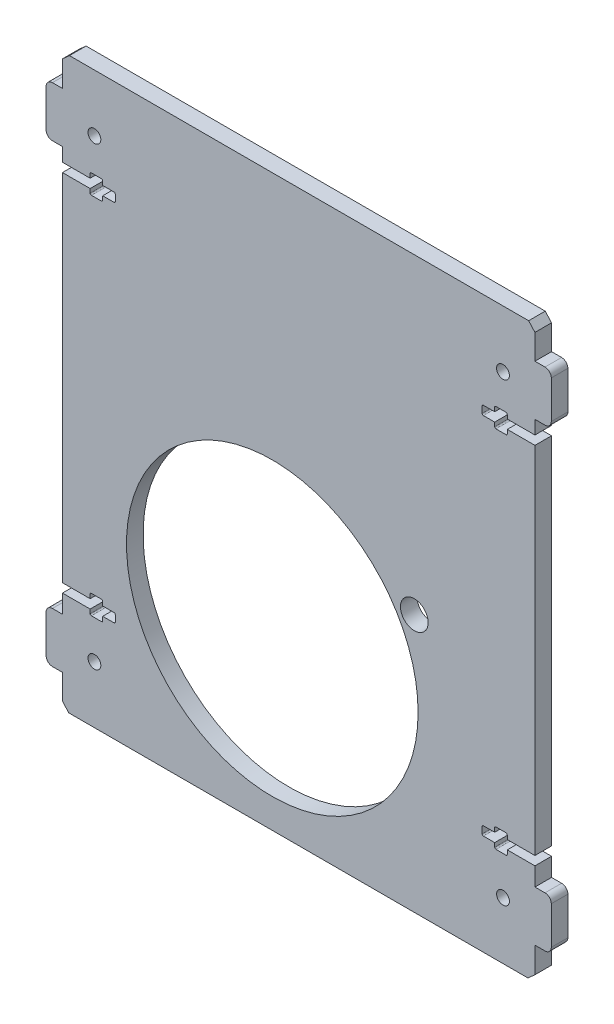
from build123d import *

# Parameters (mm, degrees)
MODEL_R             = 57.954171366
MODEL_R_2           = 2.55
MODEL_R_3           = 5.5
BOSS_EXTRUDE1_DEPTH = 6.6


with BuildPart() as part:
    # Model → Boss-Extrude1 (new body)
    with BuildSketch(Plane.XY):
        with BuildLine():
            Line((93.9, 110.423468713), (91.4, 113.2))
            Line((91.4, 113.2), (-91.123468713, 113.2))
            Line((-91.123468713, 113.2), (-93.9, 110.7))
            Line((-93.9, 110.7), (-93.9, 100.5))
            Line((-93.9, 100.5), (-97.9, 100.5))
            ThreePointArc((-97.9, 100.5), (-99.667766953, 99.767766953), (-100.4, 98))
            Line((-100.4, 98), (-100.4, 83))
            ThreePointArc((-100.4, 83), (-99.667766953, 81.232233047), (-97.9, 80.5))
            Line((-97.9, 80.5), (-93.9, 80.5))
            Line((-93.9, 80.5), (-93.9, 75.1))
            Line((-93.9, 75.1), (-82.9, 75.1))
            Line((-82.9, 75.1), (-82.9, 76.685))
            ThreePointArc((-82.9, 76.685), (-82.753553391, 77.038553391), (-82.4, 77.185))
            Line((-82.4, 77.185), (-78.4, 77.185))
            ThreePointArc((-78.4, 77.185), (-78.046446609, 77.038553391), (-77.9, 76.685))
            Line((-77.9, 76.685), (-77.9, 75.1))
            Line((-77.9, 75.1), (-73.4, 75.1))
            ThreePointArc((-73.4, 75.1), (-73.046446609, 74.953553391), (-72.9, 74.6))
            Line((-72.9, 74.6), (-72.9, 72.05))
            ThreePointArc((-72.9, 72.05), (-73.046446609, 71.696446609), (-73.4, 71.55))
            Line((-73.4, 71.55), (-77.9, 71.55))
            Line((-77.9, 71.55), (-77.9, 69.965))
            ThreePointArc((-77.9, 69.965), (-78.046446609, 69.611446609), (-78.4, 69.465))
            Line((-78.4, 69.465), (-82.4, 69.465))
            ThreePointArc((-82.4, 69.465), (-82.753553391, 69.611446609), (-82.9, 69.965))
            Line((-82.9, 69.965), (-82.9, 71.55))
            Line((-82.9, 71.55), (-93.9, 71.55))
            Line((-93.9, 71.55), (-93.9, -69.65))
            Line((-93.9, -69.65), (-82.9, -69.65))
            Line((-82.9, -69.65), (-82.9, -68.065))
            ThreePointArc((-82.9, -68.065), (-82.753553391, -67.711446609), (-82.4, -67.565))
            Line((-82.4, -67.565), (-78.4, -67.565))
            ThreePointArc((-78.4, -67.565), (-78.046446609, -67.711446609), (-77.9, -68.065))
            Line((-77.9, -68.065), (-77.9, -69.65))
            Line((-77.9, -69.65), (-73.4, -69.65))
            ThreePointArc((-73.4, -69.65), (-73.046446609, -69.796446609), (-72.9, -70.15))
            Line((-72.9, -70.15), (-72.9, -72.7))
            ThreePointArc((-72.9, -72.7), (-73.046446609, -73.053553391), (-73.4, -73.2))
            Line((-73.4, -73.2), (-77.9, -73.2))
            Line((-77.9, -73.2), (-77.9, -74.785))
            ThreePointArc((-77.9, -74.785), (-78.046446609, -75.138553391), (-78.4, -75.285))
            Line((-78.4, -75.285), (-82.4, -75.285))
            ThreePointArc((-82.4, -75.285), (-82.753553391, -75.138553391), (-82.9, -74.785))
            Line((-82.9, -74.785), (-82.9, -73.2))
            Line((-82.9, -73.2), (-93.9, -73.2))
            Line((-93.9, -73.2), (-93.9, -80.5))
            Line((-93.9, -80.5), (-97.9, -80.5))
            ThreePointArc((-97.9, -80.5), (-99.667766953, -81.232233047), (-100.4, -83))
            Line((-100.4, -83), (-100.4, -98))
            ThreePointArc((-100.4, -98), (-99.667766953, -99.767766953), (-97.9, -100.5))
            Line((-97.9, -100.5), (-93.9, -100.5))
            Line((-93.9, -100.5), (-93.9, -110.423468713))
            Line((-93.9, -110.423468713), (-91.4, -113.2))
            Line((-91.4, -113.2), (91.123468713, -113.2))
            Line((91.123468713, -113.2), (93.9, -110.7))
            Line((93.9, -110.7), (93.9, -100.5))
            Line((93.9, -100.5), (97.9, -100.5))
            ThreePointArc((97.9, -100.5), (99.667766953, -99.767766953), (100.4, -98))
            Line((100.4, -98), (100.4, -83))
            ThreePointArc((100.4, -83), (99.667766953, -81.232233047), (97.9, -80.5))
            Line((97.9, -80.5), (93.9, -80.5))
            Line((93.9, -80.5), (93.9, -73.2))
            Line((93.9, -73.2), (82.9, -73.2))
            Line((82.9, -73.2), (82.9, -74.785))
            ThreePointArc((82.9, -74.785), (82.753553391, -75.138553391), (82.4, -75.285))
            Line((82.4, -75.285), (78.4, -75.285))
            ThreePointArc((78.4, -75.285), (78.046446609, -75.138553391), (77.9, -74.785))
            Line((77.9, -74.785), (77.9, -73.2))
            Line((77.9, -73.2), (73.4, -73.2))
            ThreePointArc((73.4, -73.2), (73.046446609, -73.053553391), (72.9, -72.7))
            Line((72.9, -72.7), (72.9, -70.15))
            ThreePointArc((72.9, -70.15), (73.046446609, -69.796446609), (73.4, -69.65))
            Line((73.4, -69.65), (77.9, -69.65))
            Line((77.9, -69.65), (77.9, -68.065))
            ThreePointArc((77.9, -68.065), (78.046446609, -67.711446609), (78.4, -67.565))
            Line((78.4, -67.565), (82.4, -67.565))
            ThreePointArc((82.4, -67.565), (82.753553391, -67.711446609), (82.9, -68.065))
            Line((82.9, -68.065), (82.9, -69.65))
            Line((82.9, -69.65), (93.9, -69.65))
            Line((93.9, -69.65), (93.9, 71.55))
            Line((93.9, 71.55), (82.9, 71.55))
            Line((82.9, 71.55), (82.9, 69.965))
            ThreePointArc((82.9, 69.965), (82.753553391, 69.611446609), (82.4, 69.465))
            Line((82.4, 69.465), (78.4, 69.465))
            ThreePointArc((78.4, 69.465), (78.046446609, 69.611446609), (77.9, 69.965))
            Line((77.9, 69.965), (77.9, 71.55))
            Line((77.9, 71.55), (73.4, 71.55))
            ThreePointArc((73.4, 71.55), (73.046446609, 71.696446609), (72.9, 72.05))
            Line((72.9, 72.05), (72.9, 74.6))
            ThreePointArc((72.9, 74.6), (73.046446609, 74.953553391), (73.4, 75.1))
            Line((73.4, 75.1), (77.9, 75.1))
            Line((77.9, 75.1), (77.9, 76.685))
            ThreePointArc((77.9, 76.685), (78.046446609, 77.038553391), (78.4, 77.185))
            Line((78.4, 77.185), (82.4, 77.185))
            ThreePointArc((82.4, 77.185), (82.753553391, 77.038553391), (82.9, 76.685))
            Line((82.9, 76.685), (82.9, 75.1))
            Line((82.9, 75.1), (93.9, 75.1))
            Line((93.9, 75.1), (93.9, 80.5))
            Line((93.9, 80.5), (97.9, 80.5))
            ThreePointArc((97.9, 80.5), (99.667766953, 81.232233047), (100.4, 83))
            Line((100.4, 83), (100.4, 98))
            ThreePointArc((100.4, 98), (99.667766953, 99.767766953), (97.9, 100.5))
            Line((97.9, 100.5), (93.9, 100.5))
            Line((93.9, 100.5), (93.9, 110.423468713))
        make_face()
        with Locations((-10.493238984, -43.592)):
            Circle(MODEL_R, mode=Mode.SUBTRACT)
        with Locations((81.2, -90.5)):
            Circle(MODEL_R_2, mode=Mode.SUBTRACT)
        with Locations((81.2, 90.5)):
            Circle(MODEL_R_2, mode=Mode.SUBTRACT)
        with Locations((-81.2, 90.5)):
            Circle(MODEL_R_2, mode=Mode.SUBTRACT)
        with Locations((-81.2, -90.5)):
            Circle(MODEL_R_2, mode=Mode.SUBTRACT)
        with Locations((45.952001664, -10.724806781)):
            Circle(MODEL_R_3, mode=Mode.SUBTRACT)
    extrude(amount=BOSS_EXTRUDE1_DEPTH)


solid = part.part
